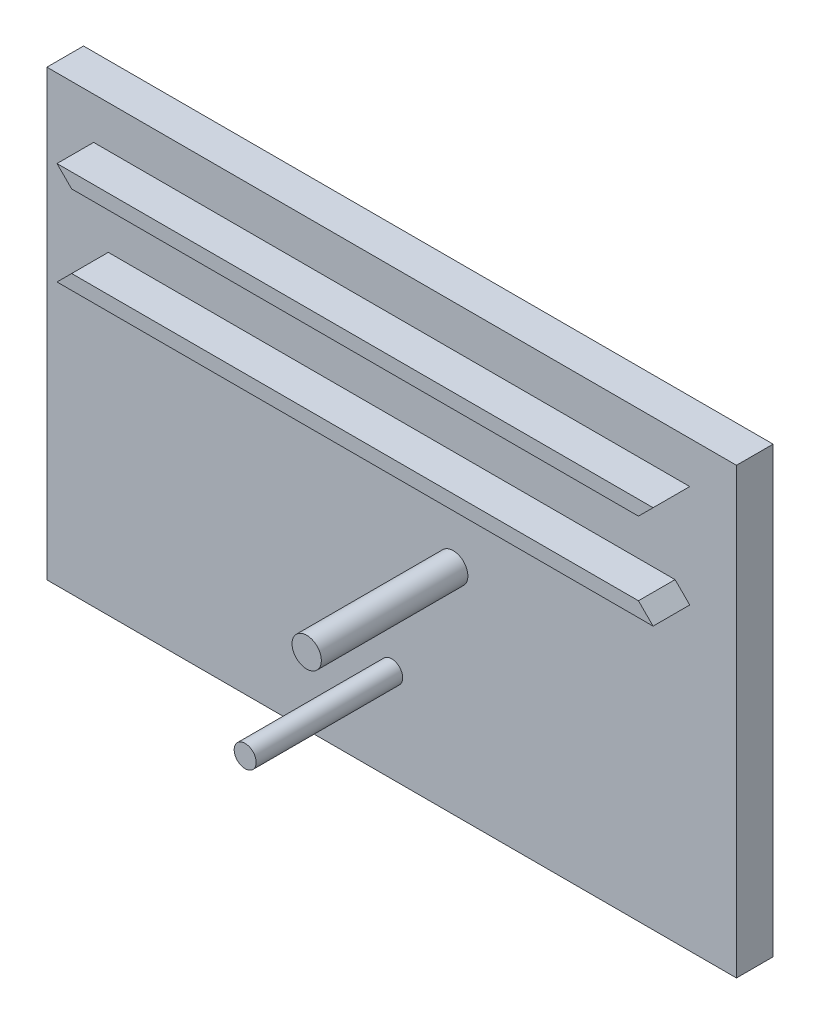
from build123d import *

# Parameters (mm, degrees)
BOSS_EXTRUDE2_DEPTH   = 12.7
BOSS_EXTRUDE2_2_DEPTH = 12.7
SKETCH2_7_W           = 239.064376672
SKETCH2_7_H           = 153.94029831
BOSS_EXTRUDE3_DEPTH   = 12.7
SKETCH2_8_R           = 3.81
SKETCH2_8_R_2         = 5.08
BOSS_EXTRUDE4_DEPTH   = 50.8


with BuildPart() as part:
    # Sketch2 → Boss-Extrude2 (new body)
    with BuildSketch(Plane.XY):
        Polygon((-103.331182916, 107.188), (-98.251182916, 102.108), (98.251182916, 102.108), (103.331182916, 107.188), align=None)
    extrude(amount=BOSS_EXTRUDE2_DEPTH)



with BuildPart() as body_2:
    # Sketch2 → Boss-Extrude2 2 (new body)
    with BuildSketch(Plane.XY):
        Polygon((103.331182916, 71.628), (98.251182916, 76.708), (-98.251182916, 76.708), (-103.331182916, 71.628), align=None)
    extrude(amount=BOSS_EXTRUDE2_2_DEPTH)


with BuildPart() as part_1:
    add(part.part)

    add(body_2.part)  # Boss-Extrude3 merges body 2
    # Sketch2<7> → Boss-Extrude3 (add)
    with BuildSketch(Plane.XY):
        with Locations((0, 44.704)):
            Rectangle(SKETCH2_7_W, SKETCH2_7_H)
    extrude(amount=-BOSS_EXTRUDE3_DEPTH)

    # Sketch2<8> → Boss-Extrude4 (add)
    with BuildSketch(Plane.XY):
        Circle(SKETCH2_8_R)
        with Locations((21.333013583, 41.868396572)):
            Circle(SKETCH2_8_R_2)
    extrude(amount=BOSS_EXTRUDE4_DEPTH)


solid = part_1.part
